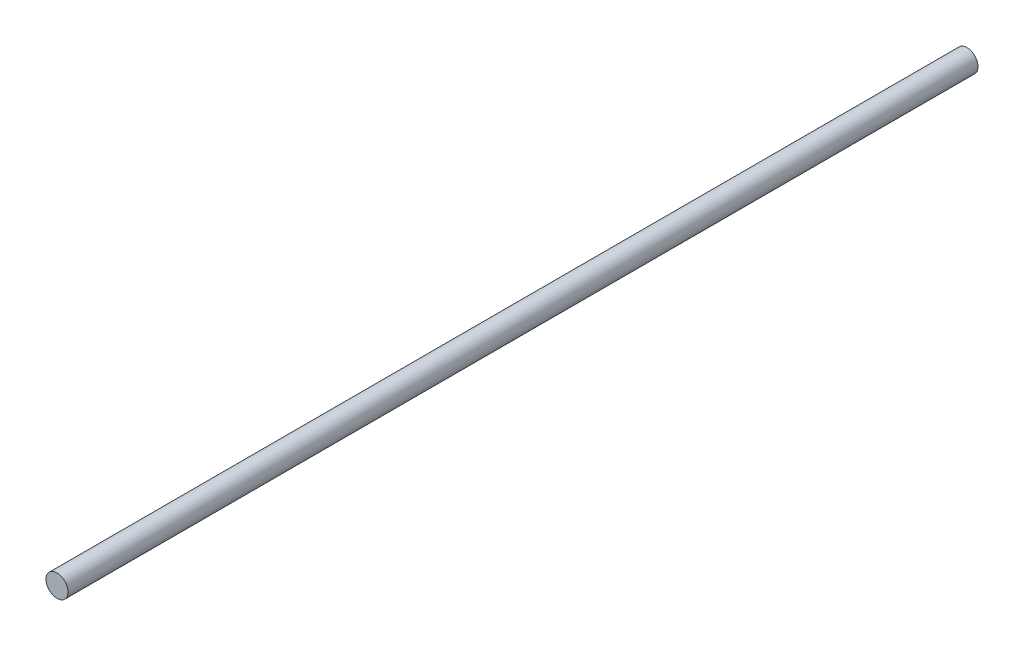
from build123d import *

# Parameters (mm, degrees)
SKETCH1_R           = 4
BOSS_EXTRUDE1_DEPTH = 330


with BuildPart() as part:
    # Sketch1 → Boss-Extrude1 (new body)
    with BuildSketch(Plane.XY):
        Circle(SKETCH1_R)
    extrude(amount=-BOSS_EXTRUDE1_DEPTH)


solid = part.part
